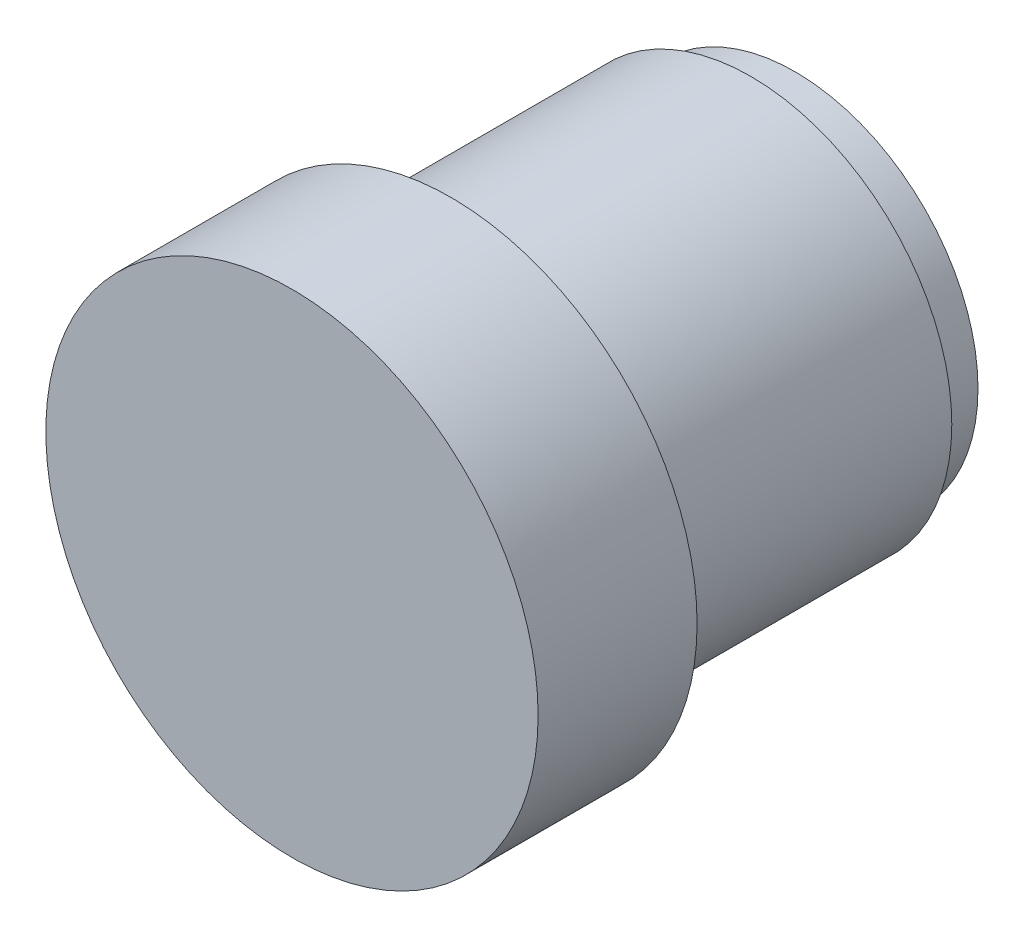
from build123d import *

# Parameters (mm, degrees)
SKETCH1_R           = 20.25
BOSS_EXTRUDE1_DEPTH = 4.9
SKETCH2_R           = 22.25
BOSS_EXTRUDE2_DEPTH = 33.2
SKETCH4_R           = 19.25
CUT_EXTRUDE2_DEPTH  = 58.2
SKETCH5_R           = 27.25
BOSS_EXTRUDE3_DEPTH = 17.6


with BuildPart() as part:
    # Sketch1 → Boss-Extrude1 (new body)
    with BuildSketch(Plane.XY):
        Circle(SKETCH1_R)
    extrude(amount=BOSS_EXTRUDE1_DEPTH)

    # Sketch2 → Boss-Extrude2 (add)
    with BuildSketch(Plane.XY.offset(4.9)):
        with Locations(Location((0, 0, 0), (0, 0, 180))):
            Circle(SKETCH2_R)
    extrude(amount=BOSS_EXTRUDE2_DEPTH)

    # Sketch4 → Cut-Extrude2 (cut)
    with BuildSketch(Plane(origin=(0, 0, 0), x_dir=(-1, 0, 0), z_dir=(0, 0, -1))):
        Circle(SKETCH4_R)
    extrude(amount=-CUT_EXTRUDE2_DEPTH, mode=Mode.SUBTRACT)

    # Sketch5 → Boss-Extrude3 (add)
    with BuildSketch(Plane.XY.offset(38.1)):
        Circle(SKETCH5_R)
    extrude(amount=BOSS_EXTRUDE3_DEPTH)


solid = part.part
